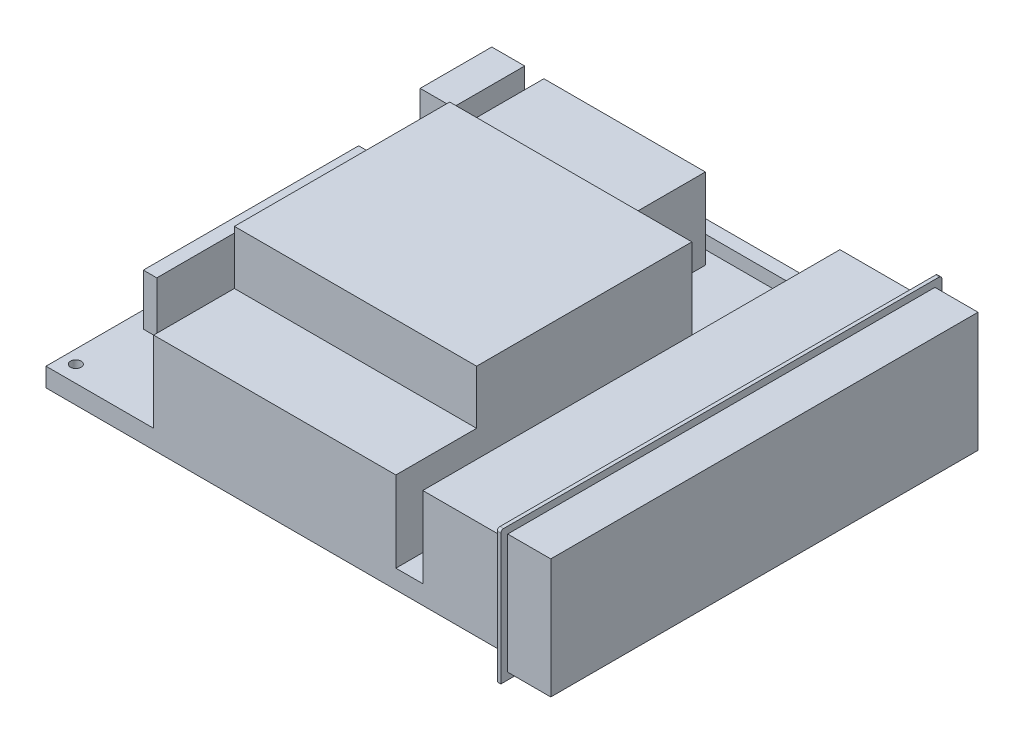
from build123d import *

# Parameters (mm, degrees)
SKETCH1_W                          = 170
SKETCH1_H                          = 170
ALUSPLAAT_DEPTH                    = 2
SKETCH2_W                          = 30
SKETCH2_H                          = 155
PISTIKUD_DEPTH                     = 35
SKETCH3_W                          = 90
SKETCH3_H                          = 110
CPU_M_LUD_DEPTH                    = 55
SKETCH4_W                          = 60
SKETCH4_H                          = 35
SININE_RADIKAS_DEPTH               = 35
SKETCH5_W                          = 90
SKETCH5_H                          = 5
PCIE_PESA_DEPTH                    = 10
SKETCH6_W                          = 12.216790721
SKETCH6_H                          = 26.62710746
RAID_PESAD_DEPTH                   = 30
SKETCH7_W                          = 170
SKETCH7_H                          = 170
LE_LDINE_M_RA_DEPTH                = 5
SKETCH8_W                          = 5
SKETCH8_H                          = 80
PATREI_JA_IGASUGUSED_L_LITID_DEPTH = 19
SKETCH9_OUTSIDE_W                  = 221.416
SKETCH9_OUTSIDE_H                  = 221.416
SKETCH9_OUTSIDE_W_2                = 90
SKETCH9_OUTSIDE_H_2                = 80
M_LUD_DEPTH                        = 20
CUT_EXTRUDE2_REACH                 = 132.192
SKETCH10_R                         = 1.98
BOSS_EXTRUDE1_DEPTH                = 1.32
SKETCH12_W                         = 158.75
SKETCH12_H                         = 44.45
BOSS_EXTRUDE2_DEPTH                = 16


with BuildPart() as part:
    # Sketch1 → alusplaat (new body)
    with BuildSketch(Plane(origin=(0, 0, 0), x_dir=(1, 0, 0), z_dir=(0, 1, 0))):
        Rectangle(SKETCH1_W, SKETCH1_H)
    extrude(amount=ALUSPLAAT_DEPTH)

    # Sketch2 → pistikud (add)
    with BuildSketch(Plane(origin=(0, 2, 0), x_dir=(-1, 0, 0), z_dir=(0, 1, 0))):
        with Locations((-70, 7.5)):
            Rectangle(SKETCH2_W, SKETCH2_H)
    extrude(amount=PISTIKUD_DEPTH)

    # Sketch3 → cpu+mälud (add)
    with BuildSketch(Plane(origin=(0, 2, 0), x_dir=(1, 0, 0), z_dir=(0, 1, 0))):
        with Locations((0, -30)):
            Rectangle(SKETCH3_W, SKETCH3_H)
    extrude(amount=CPU_M_LUD_DEPTH)

    # Sketch4 → sinine radikas (add)
    with BuildSketch(Plane(origin=(0, 2, 0), x_dir=(1, 0, 0), z_dir=(0, 1, 0))):
        with Locations((-25, 52.5)):
            Rectangle(SKETCH4_W, SKETCH4_H)
    extrude(amount=SININE_RADIKAS_DEPTH)

    # Sketch5 → pcie pesa (add)
    with BuildSketch(Plane(origin=(0, 2, 0), x_dir=(-1, 0, 0), z_dir=(0, 1, 0))):
        with Locations((0, -77.5)):
            Rectangle(SKETCH5_W, SKETCH5_H)
    extrude(amount=PCIE_PESA_DEPTH)

    # Sketch6 → raid pesad (add)
    with BuildSketch(Plane(origin=(0, 2, 0), x_dir=(-1, 0, 0), z_dir=(0, 1, 0))):
        with Locations((73.780405742, -62.225935716)):
            Rectangle(SKETCH6_W, SKETCH6_H)
    extrude(amount=RAID_PESAD_DEPTH)

    # Sketch7 → üleüldine müra (add)
    with BuildSketch(Plane(origin=(0, 2, 0), x_dir=(-1, 0, 0), z_dir=(0, 1, 0))):
        Rectangle(SKETCH7_W, SKETCH7_H)
    extrude(amount=LE_LDINE_M_RA_DEPTH)

    # Sketch8 → patrei ja igasugused lülitid (add)
    with BuildSketch(Plane(origin=(0, 7, 0), x_dir=(-1, 0, 0), z_dir=(0, 1, 0))):
        with Locations((76.340130234, 15)):
            Rectangle(SKETCH8_W, SKETCH8_H)
    extrude(amount=PATREI_JA_IGASUGUSED_L_LITID_DEPTH)

    # Sketch9 outside → mälud (cut)
    with BuildSketch(Plane(origin=(0, 57, 0), x_dir=(-1, 0, 0), z_dir=(0, 1, 0))):
        Rectangle(SKETCH9_OUTSIDE_W, SKETCH9_OUTSIDE_H)
        with Locations((0, 15)):
            Rectangle(SKETCH9_OUTSIDE_W_2, SKETCH9_OUTSIDE_H_2, mode=Mode.SUBTRACT)
    extrude(amount=-M_LUD_DEPTH, mode=Mode.SUBTRACT)

    # Sketch10 → Cut-Extrude2 (cut, up to next)
    with BuildSketch(Plane(origin=(0, 7, 0), x_dir=(1, 0, 0), z_dir=(0, 1, 0)), mode=Mode.PRIVATE) as cut_extrude2_sk1:
        with Locations(Location((74.84, 78.65, 0), (0, 0, 270))):
            Circle(SKETCH10_R)
    cut_extrude2_tool1 = extrude(cut_extrude2_sk1.sketch, amount=-CUT_EXTRUDE2_REACH, mode=Mode.PRIVATE) & part.part
    # Sketch10 → Cut-Extrude2 (cut, up to next)
    with BuildSketch(Plane(origin=(0, 7, 0), x_dir=(1, 0, 0), z_dir=(0, 1, 0)), mode=Mode.PRIVATE) as cut_extrude2_sk2:
        with Locations(Location((-80.1, 78.65, 0), (0, 0, 270))):
            Circle(SKETCH10_R)
    cut_extrude2_tool2 = extrude(cut_extrude2_sk2.sketch, amount=-CUT_EXTRUDE2_REACH, mode=Mode.PRIVATE) & part.part
    # Sketch10 → Cut-Extrude2 (cut, up to next)
    with BuildSketch(Plane(origin=(0, 7, 0), x_dir=(1, 0, 0), z_dir=(0, 1, 0)), mode=Mode.PRIVATE) as cut_extrude2_sk3:
        with Locations(Location((-80.1, -78.83, 0), (0, 0, 270))):
            Circle(SKETCH10_R)
    cut_extrude2_tool3 = extrude(cut_extrude2_sk3.sketch, amount=-CUT_EXTRUDE2_REACH, mode=Mode.PRIVATE) & part.part
    # Sketch10 → Cut-Extrude2 (cut, up to next)
    with BuildSketch(Plane(origin=(0, 7, 0), x_dir=(1, 0, 0), z_dir=(0, 1, 0)), mode=Mode.PRIVATE) as cut_extrude2_sk4:
        with Locations(Location((51.98, -78.83, 0), (0, 0, 270))):
            Circle(SKETCH10_R)
    cut_extrude2_tool4 = extrude(cut_extrude2_sk4.sketch, amount=-CUT_EXTRUDE2_REACH, mode=Mode.PRIVATE) & part.part
    add(cut_extrude2_tool1.solids().sort_by_distance((74.84, 7, -78.65))[0], mode=Mode.SUBTRACT)
    add(cut_extrude2_tool2.solids().sort_by_distance((-80.1, 7, -78.65))[0], mode=Mode.SUBTRACT)
    add(cut_extrude2_tool3.solids().sort_by_distance((-80.1, 7, 78.83))[0], mode=Mode.SUBTRACT)
    add(cut_extrude2_tool4.solids().sort_by_distance((51.98, 7, 78.83))[0], mode=Mode.SUBTRACT)


with BuildPart() as body_2:
    # Sketch11 → Boss-Extrude1 (new body)
    with BuildSketch(Plane(origin=(87.11, 0, 0), x_dir=(0, 0, -1), z_dir=(1, 0, 0))):
        with BuildLine():
            Line((-88.415, 43.18), (73.415, 43.18))
            ThreePointArc((73.415, 43.18), (74.122106781, 42.887106781), (74.415, 42.18))
            Line((74.415, 42.18), (74.415, -5.35))
            ThreePointArc((74.415, -5.35), (74.122106781, -6.057106781), (73.415, -6.35))
            Line((73.415, -6.35), (-89.415, -6.35))
            Line((-89.415, -6.35), (-89.415, 42.18))
            ThreePointArc((-89.415, 42.18), (-89.122106781, 42.887106781), (-88.415, 43.18))
        make_face()
    extrude(amount=BOSS_EXTRUDE1_DEPTH)


with BuildPart() as body_3:
    # Sketch12 → Boss-Extrude2 (new body)
    with BuildSketch(Plane(origin=(88.43, 0, 0), x_dir=(0, 0, -1), z_dir=(1, 0, 0))):
        with Locations((-7.5, 18.415)):
            Rectangle(SKETCH12_W, SKETCH12_H)
    extrude(amount=BOSS_EXTRUDE2_DEPTH)


solid = Compound([part.part, body_2.part, body_3.part])
